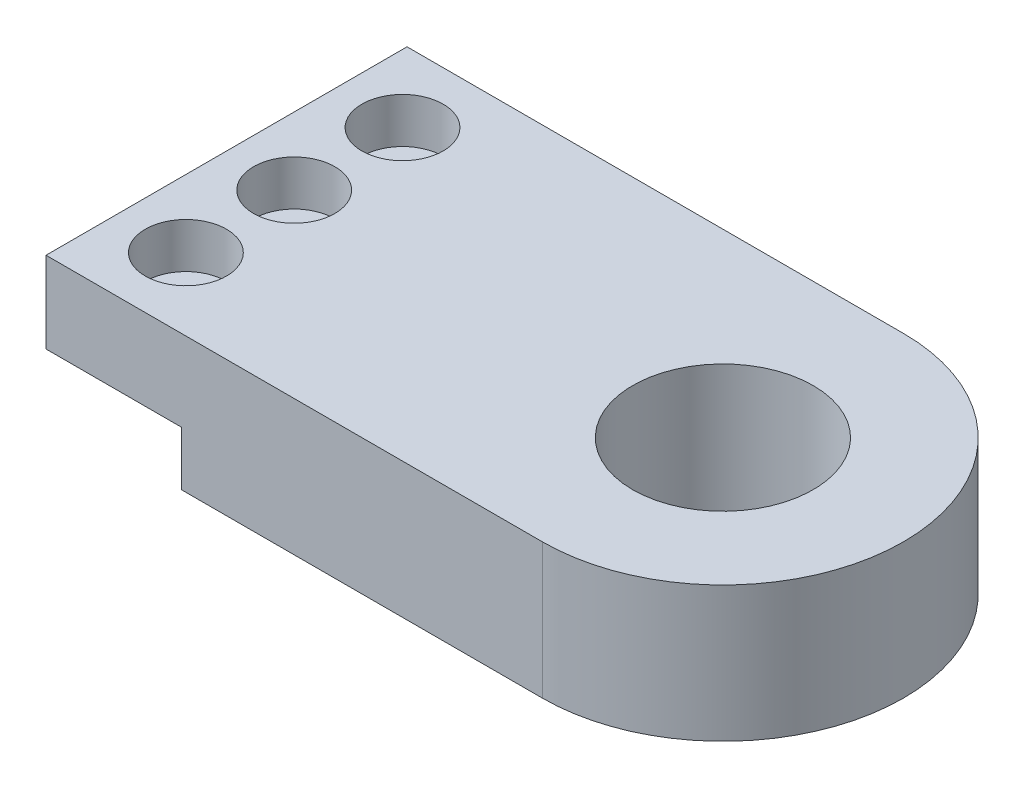
from build123d import *

# Parameters (mm, degrees)
SKETCH_1_R          = 10
EXTRUDE_1_DEPTH     = 15
SKETCH_2_W          = 15
SKETCH_2_H          = 9
EXTRUDE_2_DEPTH     = 40
CUT_EXTRUDE_1_REACH = 62.415
SKETCH_3_R          = 2.5
SKETCH_3_3_R        = 4.5
SKETCH_3_3_R_2      = 2.5
CUT_EXTRUDE_2_DEPTH = 5


with BuildPart() as part:
    # 草图1 → 凸台-拉伸1 (new body)
    with BuildSketch(Plane(origin=(0, 0, 0), x_dir=(1, 0, 0), z_dir=(0, 1, 0))):
        with BuildLine():
            Line((0, 20), (-40, 20))
            Line((-40, 20), (-40, -20))
            Line((-40, -20), (0, -20))
            ThreePointArc((0, -20), (20, 0), (0, 20))
        make_face()
        with Locations(Location((0, 0, 0), (0, 0, 270))):
            Circle(SKETCH_1_R, mode=Mode.SUBTRACT)
    extrude(amount=EXTRUDE_1_DEPTH)

    # 草图2 → 凸台-拉伸2 (add)
    with BuildSketch(Plane.XY.offset(20)):
        with Locations((-47.5, 10.5)):
            Rectangle(SKETCH_2_W, SKETCH_2_H)
    extrude(amount=-EXTRUDE_2_DEPTH)

    # 草图3 → 切除-拉伸1 (cut, up to next)
    with BuildSketch(Plane(origin=(0, 15, 0), x_dir=(1, 0, 0), z_dir=(0, 1, 0)), mode=Mode.PRIVATE) as cut_extrude_1_sk1:
        with Locations(Location((-47.5, 12, 0), (0, 0, 270))):
            Circle(SKETCH_3_R)
    cut_extrude_1_tool1 = extrude(cut_extrude_1_sk1.sketch, amount=-CUT_EXTRUDE_1_REACH, mode=Mode.PRIVATE) & part.part
    # 草图3 → 切除-拉伸1 (cut, up to next)
    with BuildSketch(Plane(origin=(0, 15, 0), x_dir=(1, 0, 0), z_dir=(0, 1, 0)), mode=Mode.PRIVATE) as cut_extrude_1_sk2:
        with Locations(Location((-47.5, 0, 0), (0, 0, 270))):
            Circle(SKETCH_3_R)
    cut_extrude_1_tool2 = extrude(cut_extrude_1_sk2.sketch, amount=-CUT_EXTRUDE_1_REACH, mode=Mode.PRIVATE) & part.part
    # 草图3 → 切除-拉伸1 (cut, up to next)
    with BuildSketch(Plane(origin=(0, 15, 0), x_dir=(1, 0, 0), z_dir=(0, 1, 0)), mode=Mode.PRIVATE) as cut_extrude_1_sk3:
        with Locations(Location((-47.5, -12, 0), (0, 0, 270))):
            Circle(SKETCH_3_R)
    cut_extrude_1_tool3 = extrude(cut_extrude_1_sk3.sketch, amount=-CUT_EXTRUDE_1_REACH, mode=Mode.PRIVATE) & part.part
    add(cut_extrude_1_tool1.solids().sort_by_distance((-47.5, 15, -12))[0], mode=Mode.SUBTRACT)
    add(cut_extrude_1_tool2.solids().sort_by_distance((-47.5, 15, 0))[0], mode=Mode.SUBTRACT)
    add(cut_extrude_1_tool3.solids().sort_by_distance((-47.5, 15, 12))[0], mode=Mode.SUBTRACT)

    # 草图3<3> → 切除-拉伸2 (cut)
    # profile 1 of 3: a face of its own
    with BuildSketch(Plane(origin=(0, 15, 0), x_dir=(1, 0, 0), z_dir=(0, 1, 0))):
        with Locations(Location((-47.5, 12, 0), (0, 0, 270))):
            Circle(SKETCH_3_3_R)
        with Locations(Location((-47.5, 12, 0), (0, 0, 270))):
            Circle(SKETCH_3_3_R_2, mode=Mode.SUBTRACT)
    # profile 2 of 3: a face of its own
    with BuildSketch(Plane(origin=(0, 15, 0), x_dir=(1, 0, 0), z_dir=(0, 1, 0))):
        with Locations(Location((-47.5, 0, 0), (0, 0, 270))):
            Circle(SKETCH_3_3_R)
        with Locations(Location((-47.5, 0, 0), (0, 0, 270))):
            Circle(SKETCH_3_3_R_2, mode=Mode.SUBTRACT)
    # profile 3 of 3: a face of its own
    with BuildSketch(Plane(origin=(0, 15, 0), x_dir=(1, 0, 0), z_dir=(0, 1, 0))):
        with Locations(Location((-47.5, -12, 0), (0, 0, 270))):
            Circle(SKETCH_3_3_R)
        with Locations(Location((-47.5, -12, 0), (0, 0, 270))):
            Circle(SKETCH_3_3_R_2, mode=Mode.SUBTRACT)
    extrude(amount=-CUT_EXTRUDE_2_DEPTH, mode=Mode.SUBTRACT)


solid = part.part
